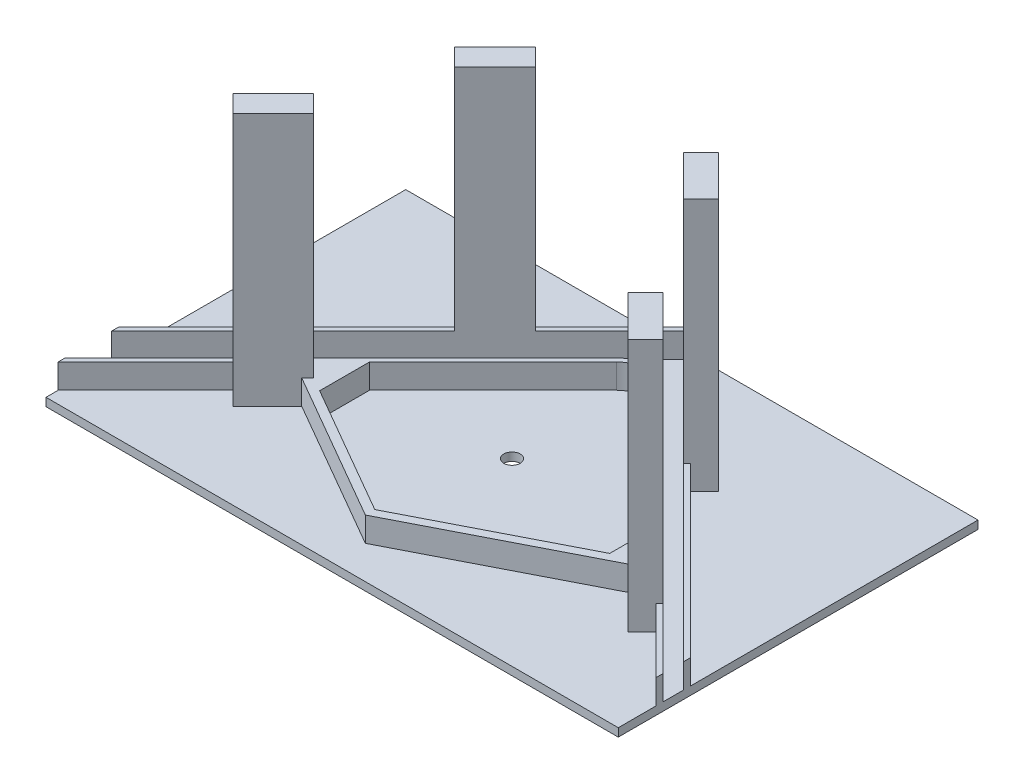
from build123d import *

# Parameters (mm, degrees)
CROQUIS2_W              = 350
CROQUIS2_H              = 220
CROQUIS2_R              = 5
SALIENTE_EXTRUIR1_DEPTH = 20
CORTAR_EXTRUIR1_DEPTH   = 7
CORTAR_EXTRUIR3_DEPTH   = 15
SALIENTE_EXTRUIR3_DEPTH = 140
CORTAR_EXTRUIR4_DEPTH   = 15
SALIENTE_EXTRUIR4_DEPTH = 15


with BuildPart() as part:
    # Croquis2 → Saliente-Extruir1 (new body)
    with BuildSketch(Plane(origin=(0, 0, 0), x_dir=(1, 0, 0), z_dir=(0, 1, 0))):
        Rectangle(CROQUIS2_W, CROQUIS2_H)
        with Locations(Location((0, 0, 0), (0, 0, 270))):
            Circle(CROQUIS2_R, mode=Mode.SUBTRACT)
    extrude(amount=SALIENTE_EXTRUIR1_DEPTH)

    # Croquis3 → Cortar-Extruir1 (cut)
    with BuildSketch(Plane(origin=(0, 20, 0), x_dir=(1, 0, 0), z_dir=(0, 1, 0))):
        Polygon((-7.505553499, 0), (-3.75277675, -6.5), (3.75277675, -6.5), (7.505553499, 0), (3.75277675, 6.5), (-3.75277675, 6.5), align=None)
    extrude(amount=-CORTAR_EXTRUIR1_DEPTH, mode=Mode.SUBTRACT)

    # Croquis8 → Cortar-Extruir3 (cut)
    with BuildSketch(Plane(origin=(0, 20, 0), x_dir=(1, 0, 0), z_dir=(0, 1, 0))):
        with BuildLine():
            Line((21.920310217, 70.351767722), (175, -82.727922061))
            Line((175, -82.727922061), (175, -70))
            Line((175, -70), (0, 105))
            Line((0, 105), (-175, -70))
            Line((-175, -70), (-175, -98.284271247))
            Line((-175, -98.284271247), (-6.363961031, 70.351767722))
            ThreePointArc((-6.363961031, 70.351767722), (7.778174593, 76.209632098), (21.920310217, 70.351767722))
        make_face()
    extrude(amount=-CORTAR_EXTRUIR3_DEPTH, mode=Mode.SUBTRACT)

    # Croquis9 → Saliente-Extruir3 (add)
    with BuildSketch(Plane(origin=(0, 20, 0), x_dir=(1, 0, 0), z_dir=(0, 1, 0))):
        Polygon((-98.994949366, -22.279220614), (-88.388347648, -32.885822331), (-113.13708499, -57.634559673), (-123.743686708, -47.027957955), align=None)
        Polygon((-70.01365227, 34.98634773), (-80.620253988, 45.592949448), (-55.871516646, 70.34168679), (-45.264914928, 59.735085072), align=None)
        Polygon((45.264914928, 59.735085072), (70.01365227, 34.98634773), (80.620253988, 45.592949448), (55.871516646, 70.34168679), align=None)
        Polygon((113.147165922, -20.875087983), (102.540564204, -31.481689701), (127.289301546, -56.230427043), (137.895903264, -45.623825325), align=None)
    extrude(amount=SALIENTE_EXTRUIR3_DEPTH)

    # Croquis10 → Cortar-Extruir4 (cut)
    with BuildSketch(Plane(origin=(0, 20, 0), x_dir=(1, 0, 0), z_dir=(0, 1, 0))):
        Polygon((-175, -65.757359313), (-175, 110), (0, 110), (175, 110), (175, -65.757359313), (72.134972613, 37.107668074), (80.620253988, 45.592949448), (55.871516646, 70.34168679), (47.386235272, 61.856405415), (0, 109.242640687), (-47.386235272, 61.856405415), (-55.871516646, 70.34168679), (-80.620253988, 45.592949448), (-72.134972613, 37.107668074), align=None)
        with BuildLine():
            Line((-96.873629023, -24.400540957), (-88.388347648, -32.885822331))
            Line((-88.388347648, -32.885822331), (-113.13708499, -57.634559673))
            Line((-113.13708499, -57.634559673), (-121.622366364, -49.149278299))
            Line((-121.622366364, -49.149278299), (-175, -102.526911935))
            Line((-175, -102.526911935), (-175, -110))
            Line((-175, -110), (175, -110))
            Line((175, -110), (175, -86.970562748))
            Line((175, -86.970562748), (135.77458292, -47.745145669))
            Line((135.77458292, -47.745145669), (127.289301546, -56.230427043))
            Line((127.289301546, -56.230427043), (102.540564204, -31.481689701))
            Line((102.540564204, -31.481689701), (111.025845579, -22.996408327))
            Line((111.025845579, -22.996408327), (19.798989873, 68.230447378))
            ThreePointArc((19.798989873, 68.230447378), (7.778174593, 73.209632098), (-4.242640687, 68.230447378))
            Line((-4.242640687, 68.230447378), (-96.873629023, -24.400540957))
        make_face()
    extrude(amount=-CORTAR_EXTRUIR4_DEPTH, mode=Mode.SUBTRACT)

    # Croquis11 → Saliente-Extruir4 (add)
    with BuildSketch(Plane(origin=(0, 5, 0), x_dir=(1, 0, 0), z_dir=(0, 1, 0))):
        Polygon((95.070154737, -35.301760182), (95.070154737, -7.040717486), (111.025845579, -22.996408327), (102.540564204, -31.481689701), (106.360634685, -35.301760182), (0, -89.690361331), (-92.048601686, -36.546076369), (-88.388347648, -32.885822331), (-96.873629023, -24.400540957), (-79.786384853, -7.313296787), (-79.786384853, -37.852167867), (0, -83.916858639), align=None)
    extrude(amount=SALIENTE_EXTRUIR4_DEPTH)


solid = part.part
